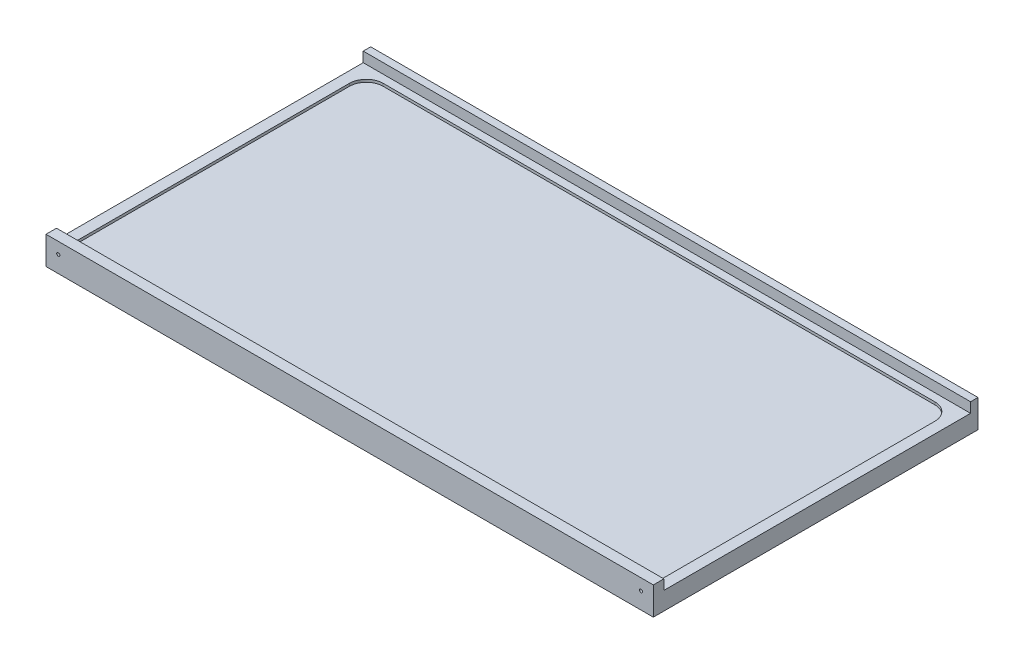
from build123d import *

# Parameters (mm, degrees)
BOSS_EXTRUDE1_DEPTH = 479.25
BOSS_EXTRUDE2_START = -50
SKETCH3_W           = 1980
SKETCH3_H           = 50
BOSS_EXTRUDE2_DEPTH = 58.5
FILLET1_R           = 55
BOSS_EXTRUDE4_START = -50
SKETCH4_W           = 1980
SKETCH4_H           = 50
BOSS_EXTRUDE4_DEPTH = 58.5
CUT_EXTRUDE1_START  = 529.25
SKETCH7_R           = 5.1
CUT_EXTRUDE1_DEPTH  = 50
BOSS_EXTRUDE5_START = 8.5
SKETCH8_W           = 1980
SKETCH8_H           = 24.25
SKETCH8_H_2         = 34.25
BOSS_EXTRUDE5_DEPTH = 32.7


with BuildPart() as part:
    # Sketch2 → Boss-Extrude1 (new, symmetric)
    with BuildSketch(Plane.XY):
        Polygon((-954.25, 0), (954.25, 0), (954.25, 8.5), (990, 8.5), (990, -50), (-990, -50), (-990, 8.5), (-954.25, 8.5), align=None)
    extrude(amount=BOSS_EXTRUDE1_DEPTH, both=True)

    # Sketch3 → Boss-Extrude2 (add)
    with BuildSketch(Plane(origin=(0, 0, 0), x_dir=(1, 0, 0), z_dir=(0, 1, 0)).offset(BOSS_EXTRUDE2_START)):
        with Locations((0, 504.25)):
            Rectangle(SKETCH3_W, SKETCH3_H)
    extrude(amount=BOSS_EXTRUDE2_DEPTH)

    # Fillet1
    fillet1_edges = [part.edges().sort_by_distance(p)[0] for p in [
        (954.25, 4.25, -479.25),
        (-954.25, 4.25, -479.25),
    ]]
    fillet(fillet1_edges, radius=FILLET1_R)

    # Sketch4 → Boss-Extrude4 (add)
    with BuildSketch(Plane(origin=(0, 0, 0), x_dir=(1, 0, 0), z_dir=(0, 1, 0)).offset(BOSS_EXTRUDE4_START)):
        with Locations((0, -504.25)):
            Rectangle(SKETCH4_W, SKETCH4_H)
    extrude(amount=BOSS_EXTRUDE4_DEPTH)

    # Sketch7 → Cut-Extrude1 (cut)
    with BuildSketch(Plane.XY.offset(CUT_EXTRUDE1_START)):
        with Locations((-950, 4.25)):
            Circle(SKETCH7_R)
        with Locations((950, 4.25)):
            Circle(SKETCH7_R)
    extrude(amount=-CUT_EXTRUDE1_DEPTH, mode=Mode.SUBTRACT)

    # Sketch8 → Boss-Extrude5 (add)
    with BuildSketch(Plane(origin=(0, 0, 0), x_dir=(1, 0, 0), z_dir=(0, 1, 0)).offset(BOSS_EXTRUDE5_START)):
        with Locations((0, 517.125)):
            Rectangle(SKETCH8_W, SKETCH8_H)
        with Locations((0, -512.125)):
            Rectangle(SKETCH8_W, SKETCH8_H_2)
    extrude(amount=BOSS_EXTRUDE5_DEPTH)


solid = part.part
